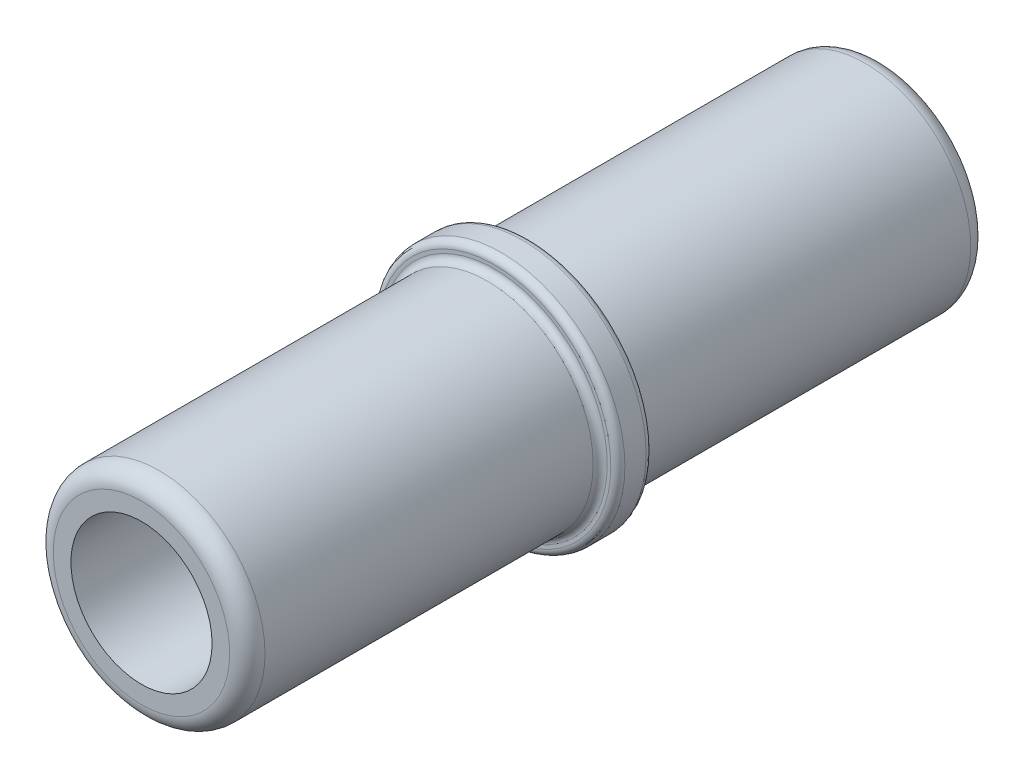
from build123d import *

# Parameters (mm, degrees)
SKETCH1_R           = 0.35
BOSS_EXTRUDE2_DEPTH = 0.1
SKETCH4_R           = 0.3
BOSS_EXTRUDE3_DEPTH = 1
BOSS_EXTRUDE4_START = 1
SKETCH5_R           = 0.3
BOSS_EXTRUDE4_DEPTH = 1
FILLET1_R           = 0.05
FILLET2_R           = 0.05
FILLET3_R           = 0.02
FILLET4_R           = 0.02
FILLET5_R           = 0.02
FILLET6_R           = 0.02
SKETCH6_R           = 0.2
CUT_EXTRUDE1_DEPTH  = 2.1


with BuildPart() as part:
    # Sketch1 → Boss-Extrude2 (new body)
    with BuildSketch(Plane.XY):
        Circle(SKETCH1_R)
    extrude(amount=BOSS_EXTRUDE2_DEPTH)

    # Sketch4 → Boss-Extrude3 (add)
    with BuildSketch(Plane.XY.offset(0.1)):
        Circle(SKETCH4_R)
    extrude(amount=BOSS_EXTRUDE3_DEPTH)

    # Sketch5 → Boss-Extrude4 (add)
    with BuildSketch(Plane(origin=(0, 0, 0), x_dir=(-1, 0, 0), z_dir=(0, 0, -1)).offset(BOSS_EXTRUDE4_START)):
        with Locations(Location((0, 0, 0), (0, 0, 180))):
            Circle(SKETCH5_R)
    extrude(amount=-BOSS_EXTRUDE4_DEPTH)

    # Fillet1
    fillet1_edges = [part.edges().sort_by_distance(p)[0] for p in [
        (-0.3, 0, 1.1),
    ]]
    fillet(fillet1_edges, radius=FILLET1_R)

    # Fillet2
    fillet2_edges = [part.edges().sort_by_distance(p)[0] for p in [
        (-0.3, 0, -1),
    ]]
    fillet(fillet2_edges, radius=FILLET2_R)

    # Fillet3
    fillet3_edges = [part.edges().sort_by_distance(p)[0] for p in [
        (-0.35, 0, 0.1),
    ]]
    fillet(fillet3_edges, radius=FILLET3_R)

    # Fillet4
    fillet4_edges = [part.edges().sort_by_distance(p)[0] for p in [
        (-0.3, 0, 0),
    ]]
    fillet(fillet4_edges, radius=FILLET4_R)

    # Fillet5
    fillet5_edges = [part.edges().sort_by_distance(p)[0] for p in [
        (-0.35, 0, 0),
    ]]
    fillet(fillet5_edges, radius=FILLET5_R)

    # Fillet6
    fillet6_edges = [part.edges().sort_by_distance(p)[0] for p in [
        (-0.3, 0, 0.1),
    ]]
    fillet(fillet6_edges, radius=FILLET6_R)

    # Sketch6 → Cut-Extrude1 (cut)
    with BuildSketch(Plane.XY.offset(1.1)):
        Circle(SKETCH6_R)
    extrude(amount=-CUT_EXTRUDE1_DEPTH, mode=Mode.SUBTRACT)


solid = part.part
